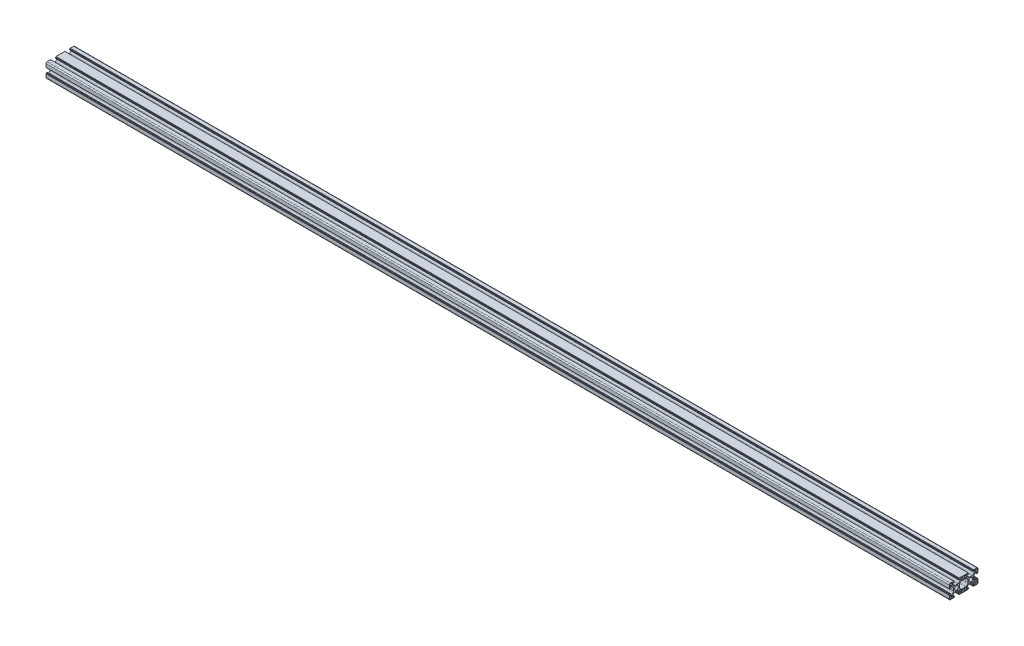
from build123d import *

# Parameters (mm, degrees)
EXTRUDE_1_DEPTH = 1260


with BuildPart() as part:
    # Эскиз1 → Бобышка-Вытянуть1 (new body)
    with BuildSketch(Plane(origin=(0, 0, 0), x_dir=(0, 0, -1), z_dir=(1, 0, 0))):
        with BuildLine():
            Line((9.247825015, 4.683728486), (11.146605684, 4.683728486))
            ThreePointArc((11.146605684, 4.683728486), (11.911972549, 4.835969421), (12.560819246, 5.269514923))
            Line((12.560819246, 5.269514923), (13.862038577, 6.570734254))
            ThreePointArc((13.862038577, 6.570734254), (14.29558408, 7.219580952), (14.447825015, 7.984947817))
            Line((14.447825015, 7.984947817), (14.447825015, 8.883728486))
            ThreePointArc((14.447825015, 8.883728486), (14.301378405, 9.237281876), (13.947825015, 9.383728486))
            Line((13.947825015, 9.383728486), (13.844931796, 9.383728486))
            ThreePointArc((13.844931796, 9.383728486), (13.65359008, 9.345668252), (13.491378405, 9.237281876))
            Line((13.491378405, 9.237281876), (13.01104832, 8.75695179))
            ThreePointArc((13.01104832, 8.75695179), (12.929942482, 8.702758603), (12.834271624, 8.683728486))
            Line((12.834271624, 8.683728486), (12.547825015, 8.683728486))
            ThreePointArc((12.547825015, 8.683728486), (12.37104832, 8.75695179), (12.297825015, 8.933728486))
            Line((12.297825015, 8.933728486), (12.297825015, 10.082799306))
            ThreePointArc((12.297825015, 10.082799306), (12.341758998, 10.188865323), (12.447825015, 10.232799306))
            Line((12.447825015, 10.232799306), (12.947825015, 10.232799306))
            Line((12.947825015, 10.232799306), (12.947825015, 10.533728486))
            ThreePointArc((12.947825015, 10.533728486), (12.991758998, 10.639794503), (13.097825015, 10.683728486))
            Line((13.097825015, 10.683728486), (17.747825015, 10.683728486))
            ThreePointArc((17.747825015, 10.683728486), (18.808485187, 10.244388658), (19.247825015, 9.183728486))
            Line((19.247825015, 9.183728486), (19.247825015, 4.533728486))
            ThreePointArc((19.247825015, 4.533728486), (19.203891032, 4.427662469), (19.097825015, 4.383728486))
            Line((19.097825015, 4.383728486), (18.796895835, 4.383728486))
            Line((18.796895835, 4.383728486), (18.796895835, 3.883728486))
            ThreePointArc((18.796895835, 3.883728486), (18.752961853, 3.777662469), (18.646895835, 3.733728486))
            Line((18.646895835, 3.733728486), (17.497825015, 3.733728486))
            ThreePointArc((17.497825015, 3.733728486), (17.32104832, 3.80695179), (17.247825015, 3.983728486))
            Line((17.247825015, 3.983728486), (17.247825015, 4.270175095))
            ThreePointArc((17.247825015, 4.270175095), (17.266855132, 4.365845953), (17.32104832, 4.44695179))
            Line((17.32104832, 4.44695179), (17.801378405, 4.927281876))
            ThreePointArc((17.801378405, 4.927281876), (17.909764781, 5.089493551), (17.947825015, 5.280835267))
            Line((17.947825015, 5.280835267), (17.947825015, 5.383728486))
            ThreePointArc((17.947825015, 5.383728486), (17.801378405, 5.737281876), (17.447825015, 5.883728486))
            Line((17.447825015, 5.883728486), (16.549044346, 5.883728486))
            ThreePointArc((16.549044346, 5.883728486), (15.783677481, 5.731487551), (15.134830783, 5.297942048))
            Line((15.134830783, 5.297942048), (13.833611452, 3.996722717))
            ThreePointArc((13.833611452, 3.996722717), (13.40006595, 3.34787602), (13.247825015, 2.582509155))
            Line((13.247825015, 2.582509155), (13.247825015, 0.683728486))
            Line((13.247825015, 0.683728486), (13.247825015, -1.215052183))
            ThreePointArc((13.247825015, -1.215052183), (13.40006595, -1.980419048), (13.833611452, -2.629265746))
            Line((13.833611452, -2.629265746), (15.134830783, -3.930485077))
            ThreePointArc((15.134830783, -3.930485077), (15.783677481, -4.364030579), (16.549044346, -4.516271514))
            Line((16.549044346, -4.516271514), (17.447825015, -4.516271514))
            ThreePointArc((17.447825015, -4.516271514), (17.801378405, -4.369824905), (17.947825015, -4.016271514))
            Line((17.947825015, -4.016271514), (17.947825015, -3.913378295))
            ThreePointArc((17.947825015, -3.913378295), (17.909764781, -3.722036579), (17.801378405, -3.559824905))
            Line((17.801378405, -3.559824905), (17.32104832, -3.079494819))
            ThreePointArc((17.32104832, -3.079494819), (17.266855132, -2.998388982), (17.247825015, -2.902718124))
            Line((17.247825015, -2.902718124), (17.247825015, -2.616271514))
            ThreePointArc((17.247825015, -2.616271514), (17.32104832, -2.439494819), (17.497825015, -2.366271514))
            Line((17.497825015, -2.366271514), (18.646895835, -2.366271514))
            ThreePointArc((18.646895835, -2.366271514), (18.752961853, -2.410205497), (18.796895835, -2.516271514))
            Line((18.796895835, -2.516271514), (18.796895835, -3.016271514))
            Line((18.796895835, -3.016271514), (19.097825015, -3.016271514))
            ThreePointArc((19.097825015, -3.016271514), (19.203891032, -3.060205497), (19.247825015, -3.166271514))
            Line((19.247825015, -3.166271514), (19.247825015, -7.816271514))
            ThreePointArc((19.247825015, -7.816271514), (18.808485187, -8.876931686), (17.747825015, -9.316271514))
            Line((17.747825015, -9.316271514), (13.097825015, -9.316271514))
            ThreePointArc((13.097825015, -9.316271514), (12.991758998, -9.272337531), (12.947825015, -9.166271514))
            Line((12.947825015, -9.166271514), (12.947825015, -8.865342335))
            Line((12.947825015, -8.865342335), (12.447825015, -8.865342335))
            ThreePointArc((12.447825015, -8.865342335), (12.341758998, -8.821408352), (12.297825015, -8.715342335))
            Line((12.297825015, -8.715342335), (12.297825015, -7.566271514))
            ThreePointArc((12.297825015, -7.566271514), (12.37104832, -7.389494819), (12.547825015, -7.316271514))
            Line((12.547825015, -7.316271514), (12.834271624, -7.316271514))
            ThreePointArc((12.834271624, -7.316271514), (12.929942482, -7.335301631), (13.01104832, -7.389494819))
            Line((13.01104832, -7.389494819), (13.491378405, -7.869824905))
            ThreePointArc((13.491378405, -7.869824905), (13.65359008, -7.978211281), (13.844931796, -8.016271514))
            Line((13.844931796, -8.016271514), (13.947825015, -8.016271514))
            ThreePointArc((13.947825015, -8.016271514), (14.301378405, -7.869824905), (14.447825015, -7.516271514))
            Line((14.447825015, -7.516271514), (14.447825015, -6.617490845))
            ThreePointArc((14.447825015, -6.617490845), (14.29558408, -5.85212398), (13.862038577, -5.203277283))
            Line((13.862038577, -5.203277283), (12.560819246, -3.902057952))
            ThreePointArc((12.560819246, -3.902057952), (11.911972549, -3.468512449), (11.146605684, -3.316271514))
            Line((11.146605684, -3.316271514), (9.247825015, -3.316271514))
            Line((9.247825015, -3.316271514), (7.349044346, -3.316271514))
            ThreePointArc((7.349044346, -3.316271514), (6.583677481, -3.468512449), (5.934830783, -3.902057952))
            Line((5.934830783, -3.902057952), (4.633611452, -5.203277283))
            ThreePointArc((4.633611452, -5.203277283), (4.20006595, -5.85212398), (4.047825015, -6.617490845))
            Line((4.047825015, -6.617490845), (4.047825015, -7.516271514))
            ThreePointArc((4.047825015, -7.516271514), (4.194271624, -7.869824905), (4.547825015, -8.016271514))
            Line((4.547825015, -8.016271514), (4.650718234, -8.016271514))
            ThreePointArc((4.650718234, -8.016271514), (4.84205995, -7.978211281), (5.004271624, -7.869824905))
            Line((5.004271624, -7.869824905), (5.48460171, -7.389494819))
            ThreePointArc((5.48460171, -7.389494819), (5.565707547, -7.335301631), (5.661378405, -7.316271514))
            Line((5.661378405, -7.316271514), (5.947825015, -7.316271514))
            ThreePointArc((5.947825015, -7.316271514), (6.12460171, -7.389494819), (6.197825015, -7.566271514))
            Line((6.197825015, -7.566271514), (6.197825015, -8.715342335))
            ThreePointArc((6.197825015, -8.715342335), (6.153891032, -8.821408352), (6.047825015, -8.865342335))
            Line((6.047825015, -8.865342335), (5.547825015, -8.865342335))
            Line((5.547825015, -8.865342335), (5.547825015, -9.166271514))
            ThreePointArc((5.547825015, -9.166271514), (5.503891032, -9.272337531), (5.397825015, -9.316271514))
            Line((5.397825015, -9.316271514), (0.747825015, -9.316271514))
            Line((0.747825015, -9.316271514), (-2.252174985, -9.316271514))
            Line((-2.252174985, -9.316271514), (-6.902174985, -9.316271514))
            ThreePointArc((-6.902174985, -9.316271514), (-7.008241002, -9.272337531), (-7.052174985, -9.166271514))
            Line((-7.052174985, -9.166271514), (-7.052174985, -8.865342335))
            Line((-7.052174985, -8.865342335), (-7.552174985, -8.865342335))
            ThreePointArc((-7.552174985, -8.865342335), (-7.658241002, -8.821408352), (-7.702174985, -8.715342335))
            Line((-7.702174985, -8.715342335), (-7.702174985, -7.566271514))
            ThreePointArc((-7.702174985, -7.566271514), (-7.62895168, -7.389494819), (-7.452174985, -7.316271514))
            Line((-7.452174985, -7.316271514), (-7.165728376, -7.316271514))
            ThreePointArc((-7.165728376, -7.316271514), (-7.070057518, -7.335301631), (-6.98895168, -7.389494819))
            Line((-6.98895168, -7.389494819), (-6.508621595, -7.869824905))
            ThreePointArc((-6.508621595, -7.869824905), (-6.34640992, -7.978211281), (-6.155068204, -8.016271514))
            Line((-6.155068204, -8.016271514), (-6.052174985, -8.016271514))
            ThreePointArc((-6.052174985, -8.016271514), (-5.698621595, -7.869824905), (-5.552174985, -7.516271514))
            Line((-5.552174985, -7.516271514), (-5.552174985, -6.617490845))
            ThreePointArc((-5.552174985, -6.617490845), (-5.70441592, -5.85212398), (-6.137961423, -5.203277283))
            Line((-6.137961423, -5.203277283), (-7.439180754, -3.902057952))
            ThreePointArc((-7.439180754, -3.902057952), (-8.088027451, -3.468512449), (-8.853394316, -3.316271514))
            Line((-8.853394316, -3.316271514), (-10.752174985, -3.316271514))
            Line((-10.752174985, -3.316271514), (-12.650955654, -3.316271514))
            ThreePointArc((-12.650955654, -3.316271514), (-13.416322519, -3.468512449), (-14.065169217, -3.902057952))
            Line((-14.065169217, -3.902057952), (-15.366388548, -5.203277283))
            ThreePointArc((-15.366388548, -5.203277283), (-15.79993405, -5.85212398), (-15.952174985, -6.617490845))
            Line((-15.952174985, -6.617490845), (-15.952174985, -7.516271514))
            ThreePointArc((-15.952174985, -7.516271514), (-15.805728376, -7.869824905), (-15.452174985, -8.016271514))
            Line((-15.452174985, -8.016271514), (-15.349281766, -8.016271514))
            ThreePointArc((-15.349281766, -8.016271514), (-15.15794005, -7.978211281), (-14.995728376, -7.869824905))
            Line((-14.995728376, -7.869824905), (-14.51539829, -7.389494819))
            ThreePointArc((-14.51539829, -7.389494819), (-14.434292453, -7.335301631), (-14.338621595, -7.316271514))
            Line((-14.338621595, -7.316271514), (-14.052174985, -7.316271514))
            ThreePointArc((-14.052174985, -7.316271514), (-13.87539829, -7.389494819), (-13.802174985, -7.566271514))
            Line((-13.802174985, -7.566271514), (-13.802174985, -8.715342335))
            ThreePointArc((-13.802174985, -8.715342335), (-13.846108968, -8.821408352), (-13.952174985, -8.865342335))
            Line((-13.952174985, -8.865342335), (-14.452174985, -8.865342335))
            Line((-14.452174985, -8.865342335), (-14.452174985, -9.166271514))
            ThreePointArc((-14.452174985, -9.166271514), (-14.496108968, -9.272337531), (-14.602174985, -9.316271514))
            Line((-14.602174985, -9.316271514), (-19.252174985, -9.316271514))
            ThreePointArc((-19.252174985, -9.316271514), (-20.312835157, -8.876931686), (-20.752174985, -7.816271514))
            Line((-20.752174985, -7.816271514), (-20.752174985, -3.166271514))
            ThreePointArc((-20.752174985, -3.166271514), (-20.708241002, -3.060205497), (-20.602174985, -3.016271514))
            Line((-20.602174985, -3.016271514), (-20.301245806, -3.016271514))
            Line((-20.301245806, -3.016271514), (-20.301245806, -2.516271514))
            ThreePointArc((-20.301245806, -2.516271514), (-20.257311823, -2.410205497), (-20.151245806, -2.366271514))
            Line((-20.151245806, -2.366271514), (-19.002174985, -2.366271514))
            ThreePointArc((-19.002174985, -2.366271514), (-18.82539829, -2.439494819), (-18.752174985, -2.616271514))
            Line((-18.752174985, -2.616271514), (-18.752174985, -2.902718124))
            ThreePointArc((-18.752174985, -2.902718124), (-18.771205102, -2.998388982), (-18.82539829, -3.079494819))
            Line((-18.82539829, -3.079494819), (-19.305728376, -3.559824905))
            ThreePointArc((-19.305728376, -3.559824905), (-19.414114751, -3.722036579), (-19.452174985, -3.913378295))
            Line((-19.452174985, -3.913378295), (-19.452174985, -4.016271514))
            ThreePointArc((-19.452174985, -4.016271514), (-19.305728376, -4.369824905), (-18.952174985, -4.516271514))
            Line((-18.952174985, -4.516271514), (-18.053394316, -4.516271514))
            ThreePointArc((-18.053394316, -4.516271514), (-17.288027451, -4.364030579), (-16.639180754, -3.930485077))
            Line((-16.639180754, -3.930485077), (-15.337961423, -2.629265746))
            ThreePointArc((-15.337961423, -2.629265746), (-14.90441592, -1.980419048), (-14.752174985, -1.215052183))
            Line((-14.752174985, -1.215052183), (-14.752174985, 0.683728486))
            Line((-14.752174985, 0.683728486), (-14.752174985, 2.582509155))
            ThreePointArc((-14.752174985, 2.582509155), (-14.90441592, 3.34787602), (-15.337961423, 3.996722717))
            Line((-15.337961423, 3.996722717), (-16.639180754, 5.297942048))
            ThreePointArc((-16.639180754, 5.297942048), (-17.288027451, 5.731487551), (-18.053394316, 5.883728486))
            Line((-18.053394316, 5.883728486), (-18.952174985, 5.883728486))
            ThreePointArc((-18.952174985, 5.883728486), (-19.305728376, 5.737281876), (-19.452174985, 5.383728486))
            Line((-19.452174985, 5.383728486), (-19.452174985, 5.280835267))
            ThreePointArc((-19.452174985, 5.280835267), (-19.414114751, 5.089493551), (-19.305728376, 4.927281876))
            Line((-19.305728376, 4.927281876), (-18.82539829, 4.44695179))
            ThreePointArc((-18.82539829, 4.44695179), (-18.771205102, 4.365845953), (-18.752174985, 4.270175095))
            Line((-18.752174985, 4.270175095), (-18.752174985, 3.983728486))
            ThreePointArc((-18.752174985, 3.983728486), (-18.82539829, 3.80695179), (-19.002174985, 3.733728486))
            Line((-19.002174985, 3.733728486), (-20.151245806, 3.733728486))
            ThreePointArc((-20.151245806, 3.733728486), (-20.257311823, 3.777662469), (-20.301245806, 3.883728486))
            Line((-20.301245806, 3.883728486), (-20.301245806, 4.383728486))
            Line((-20.301245806, 4.383728486), (-20.602174985, 4.383728486))
            ThreePointArc((-20.602174985, 4.383728486), (-20.708241002, 4.427662469), (-20.752174985, 4.533728486))
            Line((-20.752174985, 4.533728486), (-20.752174985, 9.183728486))
            ThreePointArc((-20.752174985, 9.183728486), (-20.312835157, 10.244388658), (-19.252174985, 10.683728486))
            Line((-19.252174985, 10.683728486), (-14.602174985, 10.683728486))
            ThreePointArc((-14.602174985, 10.683728486), (-14.496108968, 10.639794503), (-14.452174985, 10.533728486))
            Line((-14.452174985, 10.533728486), (-14.452174985, 10.232799306))
            Line((-14.452174985, 10.232799306), (-13.952174985, 10.232799306))
            ThreePointArc((-13.952174985, 10.232799306), (-13.846108968, 10.188865323), (-13.802174985, 10.082799306))
            Line((-13.802174985, 10.082799306), (-13.802174985, 8.933728486))
            ThreePointArc((-13.802174985, 8.933728486), (-13.87539829, 8.75695179), (-14.052174985, 8.683728486))
            Line((-14.052174985, 8.683728486), (-14.338621595, 8.683728486))
            ThreePointArc((-14.338621595, 8.683728486), (-14.434292453, 8.702758603), (-14.51539829, 8.75695179))
            Line((-14.51539829, 8.75695179), (-14.995728376, 9.237281876))
            ThreePointArc((-14.995728376, 9.237281876), (-15.15794005, 9.345668252), (-15.349281766, 9.383728486))
            Line((-15.349281766, 9.383728486), (-15.452174985, 9.383728486))
            ThreePointArc((-15.452174985, 9.383728486), (-15.805728376, 9.237281876), (-15.952174985, 8.883728486))
            Line((-15.952174985, 8.883728486), (-15.952174985, 7.984947817))
            ThreePointArc((-15.952174985, 7.984947817), (-15.79993405, 7.219580952), (-15.366388548, 6.570734254))
            Line((-15.366388548, 6.570734254), (-14.065169217, 5.269514923))
            ThreePointArc((-14.065169217, 5.269514923), (-13.416322519, 4.835969421), (-12.650955654, 4.683728486))
            Line((-12.650955654, 4.683728486), (-10.752174985, 4.683728486))
            Line((-10.752174985, 4.683728486), (-8.853394316, 4.683728486))
            ThreePointArc((-8.853394316, 4.683728486), (-8.088027451, 4.835969421), (-7.439180754, 5.269514923))
            Line((-7.439180754, 5.269514923), (-6.137961423, 6.570734254))
            ThreePointArc((-6.137961423, 6.570734254), (-5.70441592, 7.219580952), (-5.552174985, 7.984947817))
            Line((-5.552174985, 7.984947817), (-5.552174985, 8.883728486))
            ThreePointArc((-5.552174985, 8.883728486), (-5.698621595, 9.237281876), (-6.052174985, 9.383728486))
            Line((-6.052174985, 9.383728486), (-6.155068204, 9.383728486))
            ThreePointArc((-6.155068204, 9.383728486), (-6.34640992, 9.345668252), (-6.508621595, 9.237281876))
            Line((-6.508621595, 9.237281876), (-6.98895168, 8.75695179))
            ThreePointArc((-6.98895168, 8.75695179), (-7.070057518, 8.702758603), (-7.165728376, 8.683728486))
            Line((-7.165728376, 8.683728486), (-7.452174985, 8.683728486))
            ThreePointArc((-7.452174985, 8.683728486), (-7.62895168, 8.75695179), (-7.702174985, 8.933728486))
            Line((-7.702174985, 8.933728486), (-7.702174985, 10.082799306))
            ThreePointArc((-7.702174985, 10.082799306), (-7.658241002, 10.188865323), (-7.552174985, 10.232799306))
            Line((-7.552174985, 10.232799306), (-7.052174985, 10.232799306))
            Line((-7.052174985, 10.232799306), (-7.052174985, 10.533728486))
            ThreePointArc((-7.052174985, 10.533728486), (-7.008241002, 10.639794503), (-6.902174985, 10.683728486))
            Line((-6.902174985, 10.683728486), (-2.252174985, 10.683728486))
            Line((-2.252174985, 10.683728486), (0.747825015, 10.683728486))
            Line((0.747825015, 10.683728486), (5.397825015, 10.683728486))
            ThreePointArc((5.397825015, 10.683728486), (5.503891032, 10.639794503), (5.547825015, 10.533728486))
            Line((5.547825015, 10.533728486), (5.547825015, 10.232799306))
            Line((5.547825015, 10.232799306), (6.047825015, 10.232799306))
            ThreePointArc((6.047825015, 10.232799306), (6.153891032, 10.188865323), (6.197825015, 10.082799306))
            Line((6.197825015, 10.082799306), (6.197825015, 8.933728486))
            ThreePointArc((6.197825015, 8.933728486), (6.12460171, 8.75695179), (5.947825015, 8.683728486))
            Line((5.947825015, 8.683728486), (5.661378405, 8.683728486))
            ThreePointArc((5.661378405, 8.683728486), (5.565707547, 8.702758603), (5.48460171, 8.75695179))
            Line((5.48460171, 8.75695179), (5.004271624, 9.237281876))
            ThreePointArc((5.004271624, 9.237281876), (4.84205995, 9.345668252), (4.650718234, 9.383728486))
            Line((4.650718234, 9.383728486), (4.547825015, 9.383728486))
            ThreePointArc((4.547825015, 9.383728486), (4.194271624, 9.237281876), (4.047825015, 8.883728486))
            Line((4.047825015, 8.883728486), (4.047825015, 7.984947817))
            ThreePointArc((4.047825015, 7.984947817), (4.20006595, 7.219580952), (4.633611452, 6.570734254))
            Line((4.633611452, 6.570734254), (5.934830783, 5.269514923))
            ThreePointArc((5.934830783, 5.269514923), (6.583677481, 4.835969421), (7.349044346, 4.683728486))
            Line((7.349044346, 4.683728486), (9.247825015, 4.683728486))
        make_face()
        with BuildLine():
            Line((16.147825015, 6.783728486), (17.547825015, 6.783728486))
            ThreePointArc((17.547825015, 6.783728486), (18.11351044, 7.018043061), (18.347825015, 7.583728486))
            Line((18.347825015, 7.583728486), (18.347825015, 8.983728486))
            ThreePointArc((18.347825015, 8.983728486), (18.11351044, 9.549413911), (17.547825015, 9.783728486))
            Line((17.547825015, 9.783728486), (16.147825015, 9.783728486))
            ThreePointArc((16.147825015, 9.783728486), (15.58213959, 9.549413911), (15.347825015, 8.983728486))
            Line((15.347825015, 8.983728486), (15.347825015, 7.583728486))
            ThreePointArc((15.347825015, 7.583728486), (15.58213959, 7.018043061), (16.147825015, 6.783728486))
        make_face(mode=Mode.SUBTRACT)
        with BuildLine():
            Line((15.347825015, -6.216271514), (15.347825015, -7.616271514))
            ThreePointArc((15.347825015, -7.616271514), (15.58213959, -8.181956939), (16.147825015, -8.416271514))
            Line((16.147825015, -8.416271514), (17.547825015, -8.416271514))
            ThreePointArc((17.547825015, -8.416271514), (18.11351044, -8.181956939), (18.347825015, -7.616271514))
            Line((18.347825015, -7.616271514), (18.347825015, -6.216271514))
            ThreePointArc((18.347825015, -6.216271514), (18.11351044, -5.650586089), (17.547825015, -5.416271514))
            Line((17.547825015, -5.416271514), (16.147825015, -5.416271514))
            ThreePointArc((16.147825015, -5.416271514), (15.58213959, -5.650586089), (15.347825015, -6.216271514))
        make_face(mode=Mode.SUBTRACT)
        with BuildLine():
            Line((2.347825015, -5.416271514), (0.947825015, -5.416271514))
            ThreePointArc((0.947825015, -5.416271514), (0.38213959, -5.650586089), (0.147825015, -6.216271514))
            Line((0.147825015, -6.216271514), (0.147825015, -7.616271514))
            ThreePointArc((0.147825015, -7.616271514), (0.38213959, -8.181956939), (0.947825015, -8.416271514))
            Line((0.947825015, -8.416271514), (2.347825015, -8.416271514))
            ThreePointArc((2.347825015, -8.416271514), (2.91351044, -8.181956939), (3.147825015, -7.616271514))
            Line((3.147825015, -7.616271514), (3.147825015, -6.216271514))
            ThreePointArc((3.147825015, -6.216271514), (2.91351044, -5.650586089), (2.347825015, -5.416271514))
        make_face(mode=Mode.SUBTRACT)
        with BuildLine():
            Line((1.047825015, -4.516271514), (1.946605684, -4.516271514))
            ThreePointArc((1.946605684, -4.516271514), (2.711972549, -4.364030579), (3.360819246, -3.930485077))
            Line((3.360819246, -3.930485077), (4.662038577, -2.629265746))
            ThreePointArc((4.662038577, -2.629265746), (5.09558408, -1.980419048), (5.247825015, -1.215052183))
            Line((5.247825015, -1.215052183), (5.247825015, 0.683728486))
            Line((5.247825015, 0.683728486), (5.247825015, 2.582509155))
            ThreePointArc((5.247825015, 2.582509155), (5.09558408, 3.34787602), (4.662038577, 3.996722717))
            Line((4.662038577, 3.996722717), (3.360819246, 5.297942048))
            ThreePointArc((3.360819246, 5.297942048), (2.711972549, 5.731487551), (1.946605684, 5.883728486))
            Line((1.946605684, 5.883728486), (1.047825015, 5.883728486))
            Line((1.047825015, 5.883728486), (-2.552174985, 5.883728486))
            Line((-2.552174985, 5.883728486), (-3.450955654, 5.883728486))
            ThreePointArc((-3.450955654, 5.883728486), (-4.216322519, 5.731487551), (-4.865169217, 5.297942048))
            Line((-4.865169217, 5.297942048), (-6.166388548, 3.996722717))
            ThreePointArc((-6.166388548, 3.996722717), (-6.59993405, 3.34787602), (-6.752174985, 2.582509155))
            Line((-6.752174985, 2.582509155), (-6.752174985, 0.683728486))
            Line((-6.752174985, 0.683728486), (-6.752174985, -1.215052183))
            ThreePointArc((-6.752174985, -1.215052183), (-6.59993405, -1.980419048), (-6.166388548, -2.629265746))
            Line((-6.166388548, -2.629265746), (-4.865169217, -3.930485077))
            ThreePointArc((-4.865169217, -3.930485077), (-4.216322519, -4.364030579), (-3.450955654, -4.516271514))
            Line((-3.450955654, -4.516271514), (-2.552174985, -4.516271514))
            Line((-2.552174985, -4.516271514), (1.047825015, -4.516271514))
        make_face(mode=Mode.SUBTRACT)
        with BuildLine():
            Line((3.147825015, 7.583728486), (3.147825015, 8.983728486))
            ThreePointArc((3.147825015, 8.983728486), (2.91351044, 9.549413911), (2.347825015, 9.783728486))
            Line((2.347825015, 9.783728486), (0.947825015, 9.783728486))
            ThreePointArc((0.947825015, 9.783728486), (0.38213959, 9.549413911), (0.147825015, 8.983728486))
            Line((0.147825015, 8.983728486), (0.147825015, 7.583728486))
            ThreePointArc((0.147825015, 7.583728486), (0.38213959, 7.018043061), (0.947825015, 6.783728486))
            Line((0.947825015, 6.783728486), (2.347825015, 6.783728486))
            ThreePointArc((2.347825015, 6.783728486), (2.91351044, 7.018043061), (3.147825015, 7.583728486))
        make_face(mode=Mode.SUBTRACT)
        with BuildLine():
            Line((-2.452174985, 9.783728486), (-3.852174985, 9.783728486))
            ThreePointArc((-3.852174985, 9.783728486), (-4.41786041, 9.549413911), (-4.652174985, 8.983728486))
            Line((-4.652174985, 8.983728486), (-4.652174985, 7.583728486))
            ThreePointArc((-4.652174985, 7.583728486), (-4.41786041, 7.018043061), (-3.852174985, 6.783728486))
            Line((-3.852174985, 6.783728486), (-2.452174985, 6.783728486))
            ThreePointArc((-2.452174985, 6.783728486), (-1.88648956, 7.018043061), (-1.652174985, 7.583728486))
            Line((-1.652174985, 7.583728486), (-1.652174985, 8.983728486))
            ThreePointArc((-1.652174985, 8.983728486), (-1.88648956, 9.549413911), (-2.452174985, 9.783728486))
        make_face(mode=Mode.SUBTRACT)
        with BuildLine():
            Line((-1.652174985, -7.616271514), (-1.652174985, -6.216271514))
            ThreePointArc((-1.652174985, -6.216271514), (-1.88648956, -5.650586089), (-2.452174985, -5.416271514))
            Line((-2.452174985, -5.416271514), (-3.852174985, -5.416271514))
            ThreePointArc((-3.852174985, -5.416271514), (-4.41786041, -5.650586089), (-4.652174985, -6.216271514))
            Line((-4.652174985, -6.216271514), (-4.652174985, -7.616271514))
            ThreePointArc((-4.652174985, -7.616271514), (-4.41786041, -8.181956939), (-3.852174985, -8.416271514))
            Line((-3.852174985, -8.416271514), (-2.452174985, -8.416271514))
            ThreePointArc((-2.452174985, -8.416271514), (-1.88648956, -8.181956939), (-1.652174985, -7.616271514))
        make_face(mode=Mode.SUBTRACT)
        with BuildLine():
            Line((-19.052174985, -8.416271514), (-17.652174985, -8.416271514))
            ThreePointArc((-17.652174985, -8.416271514), (-17.08648956, -8.181956939), (-16.852174985, -7.616271514))
            Line((-16.852174985, -7.616271514), (-16.852174985, -6.216271514))
            ThreePointArc((-16.852174985, -6.216271514), (-17.08648956, -5.650586089), (-17.652174985, -5.416271514))
            Line((-17.652174985, -5.416271514), (-19.052174985, -5.416271514))
            ThreePointArc((-19.052174985, -5.416271514), (-19.61786041, -5.650586089), (-19.852174985, -6.216271514))
            Line((-19.852174985, -6.216271514), (-19.852174985, -7.616271514))
            ThreePointArc((-19.852174985, -7.616271514), (-19.61786041, -8.181956939), (-19.052174985, -8.416271514))
        make_face(mode=Mode.SUBTRACT)
        with BuildLine():
            Line((-19.852174985, 8.983728486), (-19.852174985, 7.583728486))
            ThreePointArc((-19.852174985, 7.583728486), (-19.61786041, 7.018043061), (-19.052174985, 6.783728486))
            Line((-19.052174985, 6.783728486), (-17.652174985, 6.783728486))
            ThreePointArc((-17.652174985, 6.783728486), (-17.08648956, 7.018043061), (-16.852174985, 7.583728486))
            Line((-16.852174985, 7.583728486), (-16.852174985, 8.983728486))
            ThreePointArc((-16.852174985, 8.983728486), (-17.08648956, 9.549413911), (-17.652174985, 9.783728486))
            Line((-17.652174985, 9.783728486), (-19.052174985, 9.783728486))
            ThreePointArc((-19.052174985, 9.783728486), (-19.61786041, 9.549413911), (-19.852174985, 8.983728486))
        make_face(mode=Mode.SUBTRACT)
        with BuildLine():
            ThreePointArc((11.747825015, 0.683728486), (11.015591968, 2.451495439), (9.247825015, 3.183728486))
            ThreePointArc((9.247825015, 3.183728486), (7.480058062, 2.451495439), (6.747825015, 0.683728486))
            ThreePointArc((6.747825015, 0.683728486), (7.480058062, -1.084038467), (9.247825015, -1.816271514))
            ThreePointArc((9.247825015, -1.816271514), (11.015591968, -1.084038467), (11.747825015, 0.683728486))
        make_face(mode=Mode.SUBTRACT)
        with BuildLine():
            ThreePointArc((-10.752174985, 3.183728486), (-8.984408032, 2.451495439), (-8.252174985, 0.683728486))
            ThreePointArc((-8.252174985, 0.683728486), (-8.984408032, -1.084038467), (-10.752174985, -1.816271514))
            ThreePointArc((-10.752174985, -1.816271514), (-12.519941938, -1.084038467), (-13.252174985, 0.683728486))
            ThreePointArc((-13.252174985, 0.683728486), (-12.519941938, 2.451495439), (-10.752174985, 3.183728486))
        make_face(mode=Mode.SUBTRACT)
    extrude(amount=EXTRUDE_1_DEPTH)


solid = part.part
